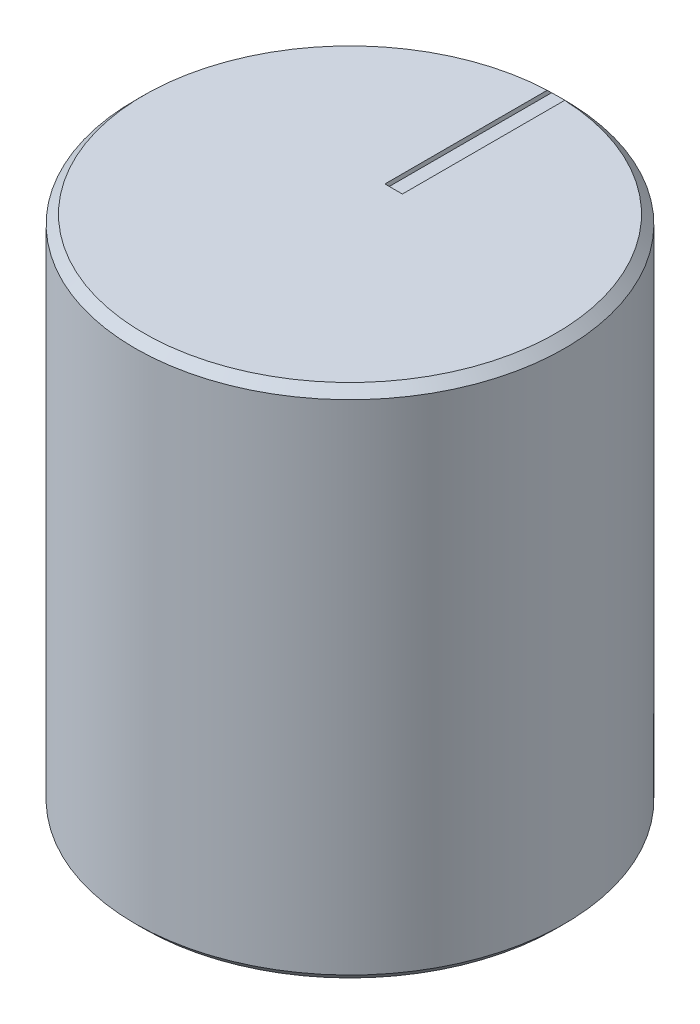
from build123d import *

# Parameters (mm, degrees)
SKETCH1_R           = 6.25
BOSS_EXTRUDE1_DEPTH = 15
CHAMFER1_SIZE       = 0.254
SKETCH2_W           = 0.508
SKETCH2_H           = 4.943764677
CUT_EXTRUDE1_DEPTH  = 0.127


with BuildPart() as part:
    # Sketch1 → Boss-Extrude1 (new body)
    with BuildSketch(Plane(origin=(0, 0, 0), x_dir=(1, 0, 0), z_dir=(0, 1, 0))):
        with Locations(Location((0, 0, 0), (0, 0, 270))):
            Circle(SKETCH1_R)
    extrude(amount=BOSS_EXTRUDE1_DEPTH)

    # Chamfer1
    chamfer1_edges = [part.edges().sort_by_distance(p)[0] for p in [
        (0, 0, -6.25),
        (0, 15, -6.25),
    ]]
    chamfer(chamfer1_edges, length=CHAMFER1_SIZE)

    # Sketch2 → Cut-Extrude1 (cut)
    with BuildSketch(Plane(origin=(0, 15, 0), x_dir=(1, 0, 0), z_dir=(0, 1, 0))):
        with Locations((0, 3.741882338)):
            Rectangle(SKETCH2_W, SKETCH2_H)
    extrude(amount=-CUT_EXTRUDE1_DEPTH, mode=Mode.SUBTRACT)


solid = part.part
